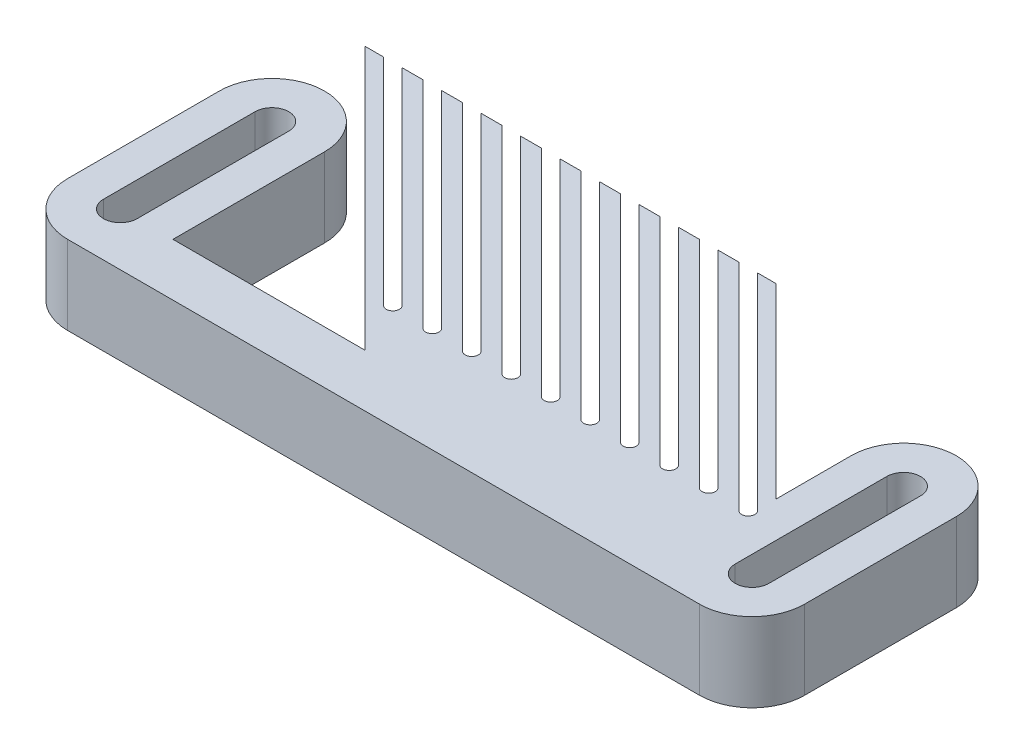
from build123d import *

# Parameters (mm, degrees)
SKETCH1_W           = 177.8
SKETCH1_H           = 76.2
BOSS_EXTRUDE1_DEPTH = 19.05
CUT_EXTRUDE1_DEPTH  = 99.578509321
LPATTERN1_COUNT     = 10
LPATTERN1_PITCH     = 9.525
CUT_EXTRUDE3_DEPTH  = 99.578509321
FILLET1_R           = 12.7
CUT_EXTRUDE4_REACH  = 100.579


with BuildPart() as part:
    # Sketch1 → Boss-Extrude1 (new body)
    with BuildSketch(Plane(origin=(0, 0, 0), x_dir=(1, 0, 0), z_dir=(0, 1, 0))):
        Rectangle(SKETCH1_W, SKETCH1_H)
    extrude(amount=BOSS_EXTRUDE1_DEPTH)

    # Sketch2 → Cut-Extrude1 (cut, through all)
    with BuildSketch(Plane(origin=(0, 19.05, 0), x_dir=(1, 0, 0), z_dir=(0, 1, 0))):
        with BuildLine():
            Line((-76.2, 38.1), (-24.277467985, -13.822532015))
            ThreePointArc((-24.277467985, -13.822532015), (-22.032403955, -13.822532015), (-22.032403955, -11.577467985))
            Line((-22.032403955, -11.577467985), (-71.709871939, 38.1))
            Line((-71.709871939, 38.1), (-76.2, 38.1))
        make_face()
    cut_extrude1 = extrude(amount=-CUT_EXTRUDE1_DEPTH, mode=Mode.SUBTRACT)

    # LPattern1: Cut-Extrude1 ×10
    with Locations(*[(i * LPATTERN1_PITCH, 0, 0) for i in range(1, LPATTERN1_COUNT)]):
        add(cut_extrude1, mode=Mode.SUBTRACT)

    # Sketch3 → Cut-Extrude3 (cut, through all)
    with BuildSketch(Plane(origin=(0, 19.05, 0), x_dir=(1, 0, 0), z_dir=(0, 1, 0))):
        with BuildLine():
            Line((-72.136, 11.176), (-72.136, -25.4))
            ThreePointArc((-72.136, -25.4), (-76.2, -29.464), (-80.264, -25.4))
            Line((-80.264, -25.4), (-80.264, 11.176))
            ThreePointArc((-80.264, 11.176), (-76.2, 15.24), (-72.136, 11.176))
        make_face()
        with BuildLine():
            Line((80.264, 11.176), (80.264, -25.4))
            ThreePointArc((80.264, -25.4), (76.2, -29.464), (72.136, -25.4))
            Line((72.136, -25.4), (72.136, 11.176))
            ThreePointArc((72.136, 11.176), (76.2, 15.24), (80.264, 11.176))
        make_face()
    extrude(amount=-CUT_EXTRUDE3_DEPTH, mode=Mode.SUBTRACT)

    # Fillet1
    fillet1_edges = [part.edges().sort_by_distance(p)[0] for p in [
        (88.9, 9.525, 38.1),
        (-88.9, 9.525, 38.1),
    ]]
    fillet(fillet1_edges, radius=FILLET1_R)

    # Sketch5 → Cut-Extrude4 (cut, up to next)
    with BuildSketch(Plane(origin=(0, 19.05, 0), x_dir=(1, 0, 0), z_dir=(0, 1, 0)), mode=Mode.PRIVATE) as cut_extrude4_sk1:
        with BuildLine():
            Line((-88.9, 38.1), (-88.9, 11.176))
            ThreePointArc((-88.9, 11.176), (-76.2, 23.876), (-63.5, 11.176))
            Line((-63.5, 11.176), (-63.5, -25.4))
            Line((-63.5, -25.4), (-17.190128061, -25.4))
            Line((-17.190128061, -25.4), (-80.690128061, 38.1))
            Line((-80.690128061, 38.1), (-88.9, 38.1))
        make_face()
    cut_extrude4_tool1 = extrude(cut_extrude4_sk1.sketch, amount=-CUT_EXTRUDE4_REACH, mode=Mode.PRIVATE) & part.part
    # Sketch5 → Cut-Extrude4 (cut, up to next)
    with BuildSketch(Plane(origin=(0, 19.05, 0), x_dir=(1, 0, 0), z_dir=(0, 1, 0)), mode=Mode.PRIVATE) as cut_extrude4_sk2:
        with BuildLine():
            Line((88.9, 38.1), (88.9, 11.176))
            ThreePointArc((88.9, 11.176), (76.2, 23.876), (63.5, 11.176))
            Line((63.5, 11.176), (63.5, -6.894743879))
            Line((63.5, -6.894743879), (18.505256121, 38.1))
            Line((18.505256121, 38.1), (88.9, 38.1))
        make_face()
    cut_extrude4_tool2 = extrude(cut_extrude4_sk2.sketch, amount=-CUT_EXTRUDE4_REACH, mode=Mode.PRIVATE) & part.part
    add(cut_extrude4_tool1.solids().sort_by_distance((-54.694692, 19.05, 2.076877))[0], mode=Mode.SUBTRACT)
    add(cut_extrude4_tool2.solids().sort_by_distance((56.766727, 19.05, -24.977603))[0], mode=Mode.SUBTRACT)


solid = part.part
